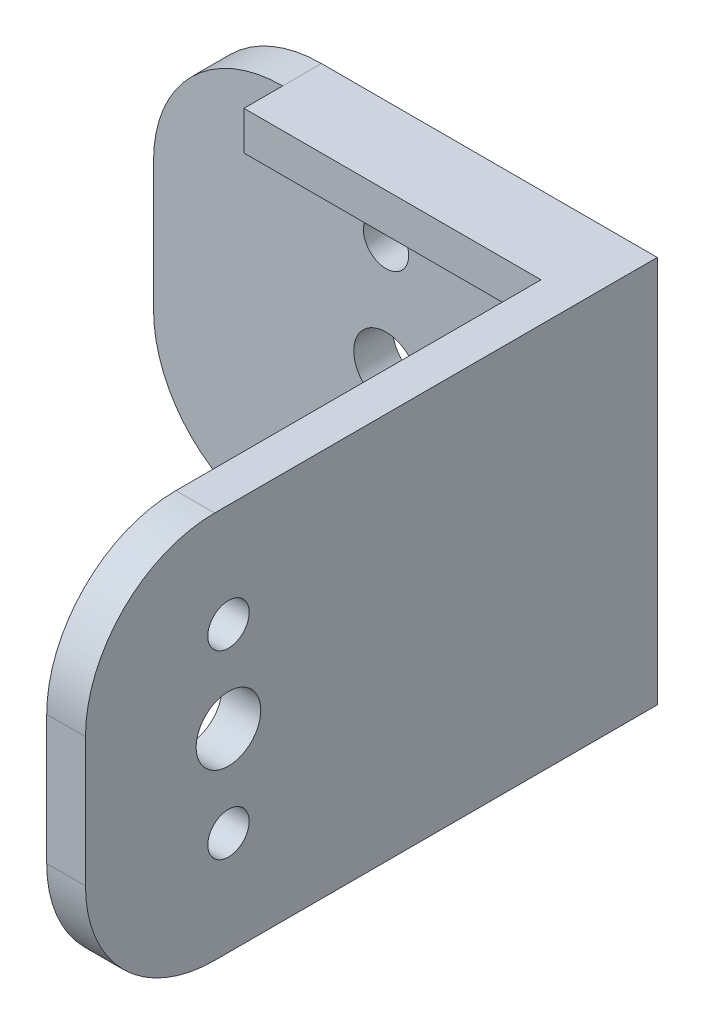
from build123d import *

# Parameters (mm, degrees)
ESQUISSE1_W             = 3
ESQUISSE1_H             = 30
BOSS_EXTRU_1_DEPTH      = 41.27
ESQUISSE1_3_W           = 36
ESQUISSE1_3_H           = 30
BOSS_EXTRU_2_DEPTH      = 3
ESQUISSE3_R             = 2.5
ESQUISSE3_R_2           = 1.6
ENL_V_MAT_EXTRU_2_DEPTH = 85
CONG_2_R                = 2
CONG_3_R                = 10
ESQUISSE7_R             = 2.5
ESQUISSE7_R_2           = 1.75
ENL_V_MAT_EXTRU_3_DEPTH = 10
ESQUISSE8_W             = 23
ESQUISSE8_H             = 3
BOSS_EXTRU_3_DEPTH      = 3


with BuildPart() as part:
    # Esquisse1 → Boss.-Extru.1 (new body)
    with BuildSketch(Plane.XY):
        with Locations((34.5, 15)):
            Rectangle(ESQUISSE1_W, ESQUISSE1_H)
    extrude(amount=BOSS_EXTRU_1_DEPTH)

    # Esquisse1<3> → Boss.-Extru.2 (add)
    with BuildSketch(Plane.XY):
        with Locations((18, 15)):
            Rectangle(ESQUISSE1_3_W, ESQUISSE1_3_H)
    extrude(amount=-BOSS_EXTRU_2_DEPTH)

    # Esquisse3 → Enlèv. mat.-Extru.2 (cut)
    with BuildSketch(Plane(origin=(36, 0, 0), x_dir=(0, 0, -1), z_dir=(1, 0, 0))):
        with Locations((-30.197874881, 15)):
            Circle(ESQUISSE3_R)
        with Locations((-30.197874881, 22)):
            Circle(ESQUISSE3_R_2)
        with Locations((-30.197874881, 8)):
            Circle(ESQUISSE3_R_2)
    extrude(amount=-ENL_V_MAT_EXTRU_2_DEPTH, mode=Mode.SUBTRACT)

    # Congé2
    cong_2_edges = [part.edges().sort_by_distance(p)[0] for p in [
        (33, 15, 0),
    ]]
    fillet(cong_2_edges, radius=CONG_2_R)

    # Congé3
    cong_3_edges = [part.edges().sort_by_distance(p)[0] for p in [
        (0, 30, -1.5),
        (0, 0, -1.5),
        (34.5, 30, 41.27),
        (34.5, 0, 41.27),
    ]]
    fillet(cong_3_edges, radius=CONG_3_R)

    # Esquisse7 → Enlèv. mat.-Extru.3 (cut)
    with BuildSketch(Plane(origin=(0, 0, -3), x_dir=(-1, 0, 0), z_dir=(0, 0, -1))):
        with Locations((-18, 15)):
            Circle(ESQUISSE7_R)
        with Locations((-18, 23.5)):
            Circle(ESQUISSE7_R_2)
        with Locations((-18, 6.5)):
            Circle(ESQUISSE7_R_2)
    extrude(amount=-ENL_V_MAT_EXTRU_3_DEPTH, mode=Mode.SUBTRACT)

    # Esquisse8 → Boss.-Extru.3 (add)
    with BuildSketch(Plane.XY):
        with Locations((21.5, 28.5)):
            Rectangle(ESQUISSE8_W, ESQUISSE8_H)
        with Locations((21.5, 1.5)):
            Rectangle(ESQUISSE8_W, ESQUISSE8_H)
    extrude(amount=BOSS_EXTRU_3_DEPTH)


solid = part.part
